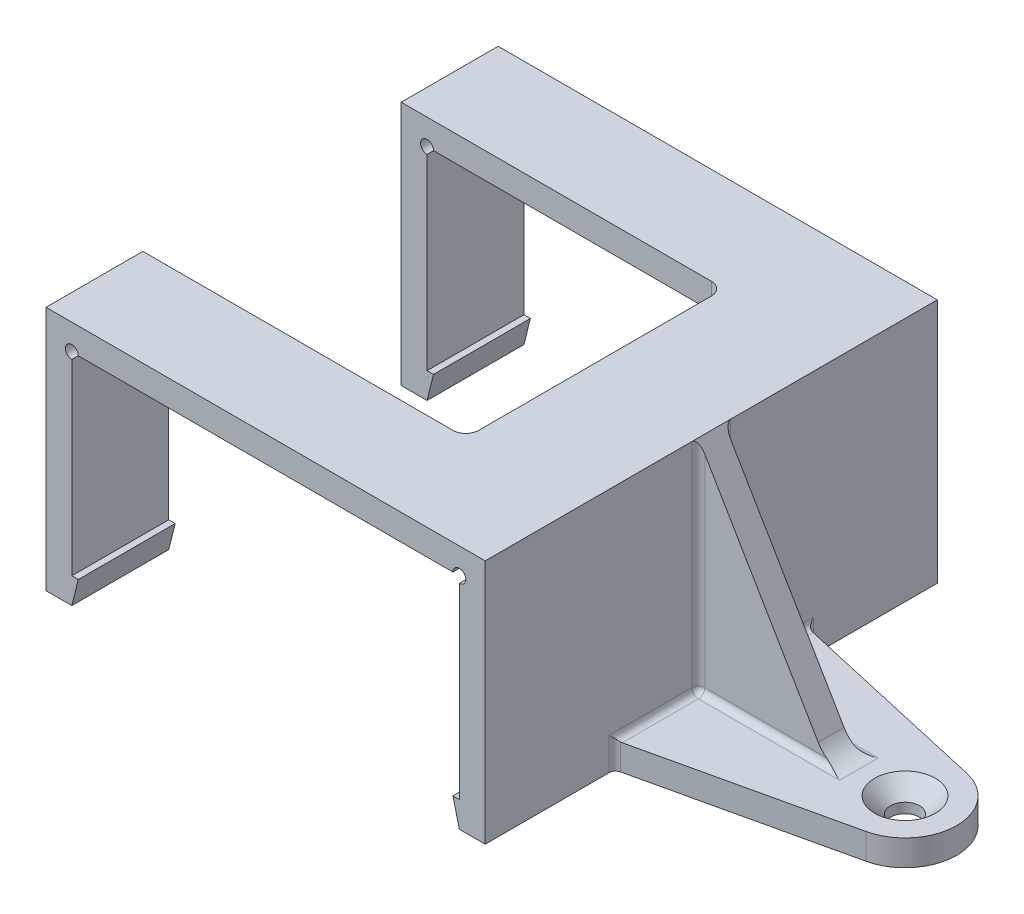
from build123d import *

# Parameters (mm, degrees)
FORME_PRINCIPALE_DEPTH  = 35
ESQUISSE3_W             = 50
ESQUISSE3_H             = 40
VIDEMENT_DEPTH          = 86.399063227
BOSSAGE_CROU_DEPTH      = 4
NERVURE3_REACH          = 119.919
ESQUISSE9_WALL_W        = 277.285093932
ESQUISSE9_WALL_H        = 4
CONG_2_R                = 1
CONG_3_R                = 5
CONG_4_R                = 2
ESQUISSE10_R            = 1
ENL_V_MAT_EXTRU_1_DEPTH = 133.589592352
ESQUISSE11_W            = 1
ESQUISSE11_H            = 40
ENL_V_MAT_EXTRU_2_DEPTH = 117.691902033


with BuildPart() as part:
    # Esquisse1 → Forme principale (new, symmetric)
    with BuildSketch(Plane.XY):
        Polygon((0, -38), (0, 0), (68, 0), (68, -38), (64, -38), (63, -34), (64, -34), (64, -4), (4, -4), (4, -34), (5, -34), (4, -38), align=None)
    extrude(amount=FORME_PRINCIPALE_DEPTH, both=True)

    # Esquisse3 → videment (cut, through all)
    with BuildSketch(Plane(origin=(0, 0, 0), x_dir=(1, 0, 0), z_dir=(0, 1, 0))):
        with Locations((25, 0)):
            Rectangle(ESQUISSE3_W, ESQUISSE3_H)
    extrude(amount=-VIDEMENT_DEPTH, mode=Mode.SUBTRACT)

    # Esquisse4 → Bossage écrou (add)
    with BuildSketch(Plane.XZ.offset(38)):
        with BuildLine():
            Line((68, 15), (99.767786128, 7.802238923))
            ThreePointArc((99.767786128, 7.802238923), (106, 0), (99.767786128, -7.802238923))
            Line((99.767786128, -7.802238923), (68, -15))
            Line((68, -15), (68, 15))
        make_face()
    extrude(amount=-BOSSAGE_CROU_DEPTH)

    # Esquisse7 → Fraisage pour vis à tête fraisée M41 (revolve, cut)
    with BuildSketch(Plane(origin=(98, -34, 0), x_dir=(0, 0, 1), z_dir=(1, 0, 0))):
        Polygon((0, 0), (0, 4.00005), (2.25, 4.00005), (2.25, 2.45), (4.7, 0), align=None)
    revolve(axis=Axis((98, -27.65, 0), (0, -1, 0)), mode=Mode.SUBTRACT)

    # Esquisse9 wall → Nervure3 (add, up to next)
    with BuildSketch(Plane(origin=(78, -17, 0), x_dir=(0.507020126563, -0.861934215158, 0), z_dir=(0.861934215158, 0.507020126563, 0)), mode=Mode.PRIVATE) as nervure3_sk1:
        Rectangle(ESQUISSE9_WALL_W, ESQUISSE9_WALL_H)
    nervure3_tool1 = extrude(nervure3_sk1.sketch, amount=-NERVURE3_REACH, mode=Mode.PRIVATE) - part.part
    add(nervure3_tool1.solids().sort_by_distance((78, -17, 0))[0])

    # Congé2
    cong_2_edges = [part.edges().sort_by_distance(p)[0] for p in [
        (68, -34, -8.5),
        (78, -34, -2),
        (68, -17, -2),
        (78, -34, 2),
        (68, -34, 8.5),
        (68, -17, 2),
        (68, -36, -15),
        (68, -36, 15),
    ]]
    fillet(cong_2_edges, radius=CONG_2_R)

    # Congé3
    cong_3_edges = [part.edges().sort_by_distance(p)[0] for p in [
        (88, -34, 0),
    ]]
    fillet(cong_3_edges, radius=CONG_3_R)

    # Congé4
    cong_4_edges = [part.edges().sort_by_distance(p)[0] for p in [
        (50, -2, -20),
        (50, -2, 20),
    ]]
    fillet(cong_4_edges, radius=CONG_4_R)

    # Esquisse10 → Enlèv. mat.-Extru.1 (cut, through all)
    with BuildSketch(Plane(origin=(0, 0, -35), x_dir=(-1, 0, 0), z_dir=(0, 0, -1))):
        with Locations((-64, -4)):
            Circle(ESQUISSE10_R)
        with Locations((-4, -4)):
            Circle(ESQUISSE10_R)
    extrude(amount=-ENL_V_MAT_EXTRU_1_DEPTH, mode=Mode.SUBTRACT)

    # Esquisse11 → Enlèv. mat.-Extru.2 (cut, through all)
    with BuildSketch(Plane(origin=(0, -34, 0), x_dir=(1, 0, 0), z_dir=(0, 1, 0))):
        with Locations((63.5, 0)):
            Rectangle(ESQUISSE11_W, ESQUISSE11_H)
    extrude(amount=-ENL_V_MAT_EXTRU_2_DEPTH, mode=Mode.SUBTRACT)


solid = part.part
